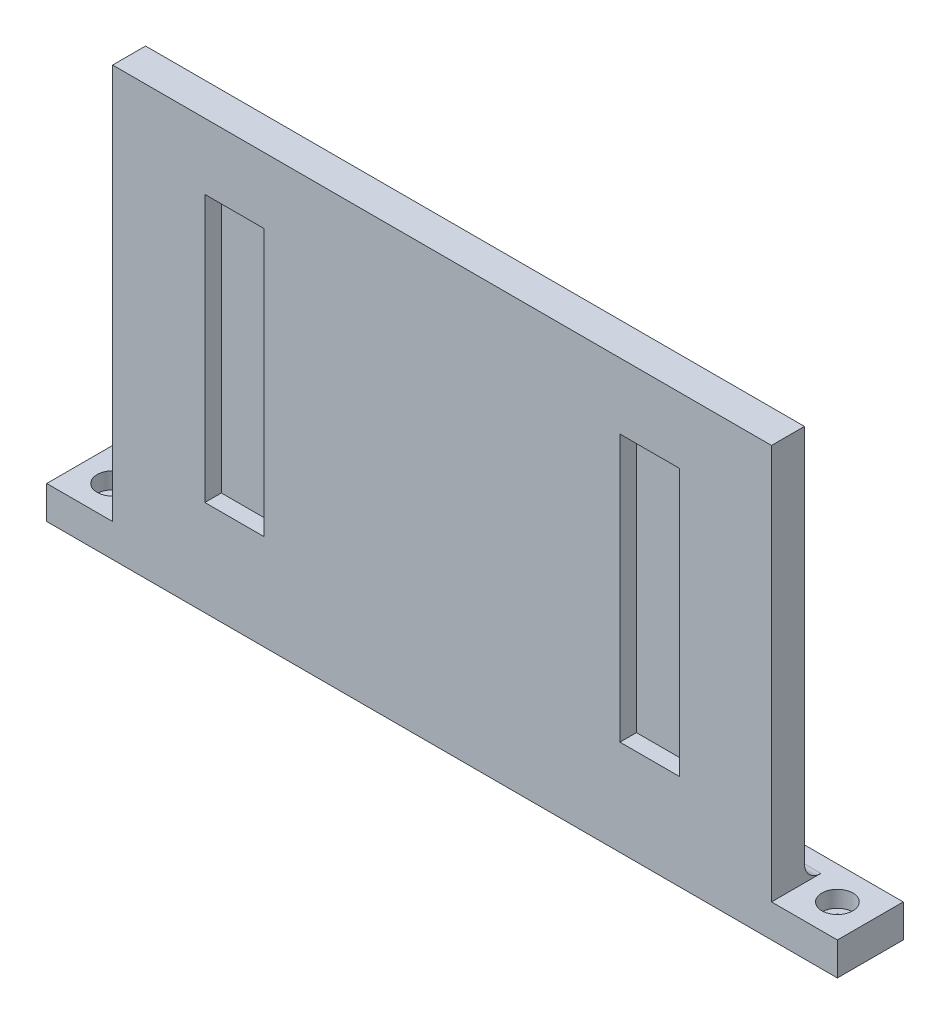
from build123d import *

# Parameters (mm, degrees)
BOSS_EXTRUDE2_DEPTH = 20
SKETCH2_R           = 3
CUT_EXTRUDE1_DEPTH  = 20
SKETCH3_W           = 200
SKETCH3_H           = 120
CUT_EXTRUDE2_DEPTH  = 10
FILLET1_R           = 5
BOSS_EXTRUDE3_START = -10
SKETCH6_R           = 3
SKETCH6_R_2         = 2.5
BOSS_EXTRUDE3_DEPTH = 10
SKETCH7_R           = 4.7
CUT_EXTRUDE6_DEPTH  = 5
SKETCH4_W           = 18
SKETCH4_H           = 81
CUT_EXTRUDE7_DEPTH  = 5


with BuildPart() as part:
    # Sketch1 → Boss-Extrude2 (new body)
    with BuildSketch(Plane.XY):
        Polygon((0, 0), (240, 0), (240, 10), (220, 10), (220, 130), (20, 130), (20, 10), (0, 10), align=None)
    extrude(amount=BOSS_EXTRUDE2_DEPTH)

    # Sketch2 → Cut-Extrude1 (cut)
    with BuildSketch(Plane(origin=(0, 10, 0), x_dir=(1, 0, 0), z_dir=(0, 1, 0))):
        with Locations(Location((10, -10, 0), (0, 0, 180))):
            Circle(SKETCH2_R)
        with Locations(Location((230, -10, 0), (0, 0, 180))):
            Circle(SKETCH2_R)
    extrude(amount=-CUT_EXTRUDE1_DEPTH, mode=Mode.SUBTRACT)

    # Sketch3 → Cut-Extrude2 (cut)
    with BuildSketch(Plane(origin=(0, 0, 0), x_dir=(-1, 0, 0), z_dir=(0, 0, -1))):
        with Locations((-120, 70)):
            Rectangle(SKETCH3_W, SKETCH3_H)
    extrude(amount=-CUT_EXTRUDE2_DEPTH, mode=Mode.SUBTRACT)

    # Fillet1
    fillet1_edges = [part.edges().sort_by_distance(p)[0] for p in [
        (120, 10, 10),
    ]]
    fillet(fillet1_edges, radius=FILLET1_R)

    # Sketch6 → Boss-Extrude3 (add)
    # profile 1 of 2: a face of its own
    with BuildSketch(Plane.XZ.offset(BOSS_EXTRUDE3_START)):
        with Locations((10, 10)):
            Circle(SKETCH6_R)
        with Locations(Location((10, 10, 0), (0, 0, 270))):
            Circle(SKETCH6_R_2, mode=Mode.SUBTRACT)
    # profile 2 of 2: a face of its own
    with BuildSketch(Plane.XZ.offset(BOSS_EXTRUDE3_START)):
        with Locations((230, 10)):
            Circle(SKETCH6_R)
        with Locations(Location((230, 10, 0), (0, 0, 270))):
            Circle(SKETCH6_R_2, mode=Mode.SUBTRACT)
    extrude(amount=BOSS_EXTRUDE3_DEPTH)

    # Sketch7 → Cut-Extrude6 (cut)
    with BuildSketch(Plane(origin=(0, 10, 0), x_dir=(1, 0, 0), z_dir=(0, 1, 0))):
        with Locations(Location((230, -10, 0), (0, 0, 180))):
            Circle(SKETCH7_R)
        with Locations(Location((10, -10, 0), (0, 0, 180))):
            Circle(SKETCH7_R)
    extrude(amount=-CUT_EXTRUDE6_DEPTH, mode=Mode.SUBTRACT)

    # Sketch4 → Cut-Extrude7 (cut)
    with BuildSketch(Plane.XY.offset(20)):
        with Locations((57, 69.5)):
            Rectangle(SKETCH4_W, SKETCH4_H)
        with Locations((183, 69.5)):
            Rectangle(SKETCH4_W, SKETCH4_H)
    extrude(amount=-CUT_EXTRUDE7_DEPTH, mode=Mode.SUBTRACT)


solid = part.part
